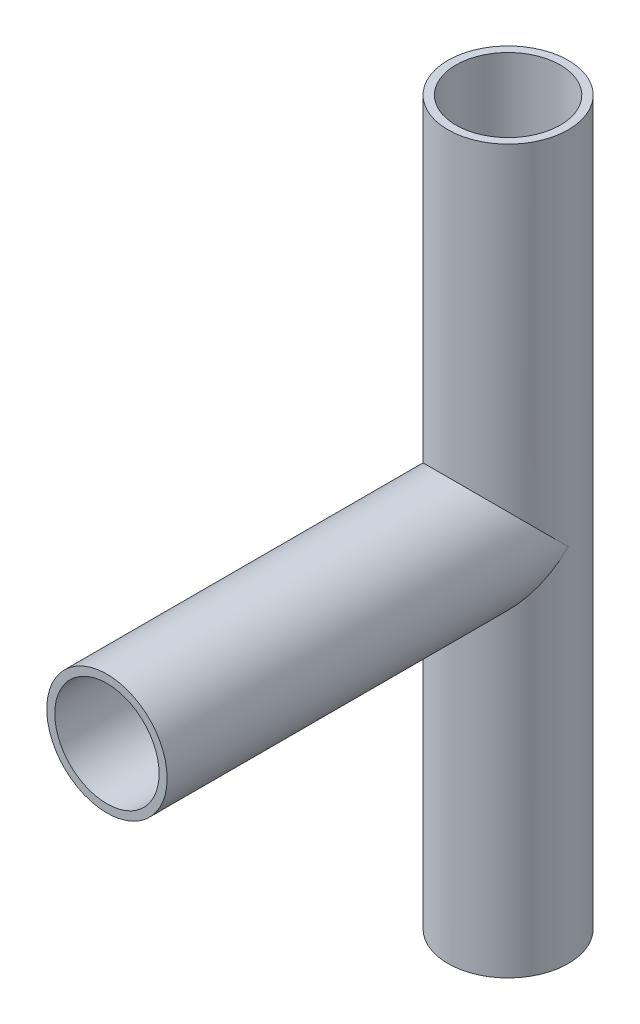
from build123d import *

# Parameters (mm, degrees)
SKETCH1_R               = 15
SKETCH1_R_2             = 13
BOSS_EXTRUDE1_DEPTH     = 100
SKETCH2_R               = 15
CUT_EXTRUDE1_DEPTH      = 100
CUT_EXTRUDE4_DEPTH      = 103.225241628
CUT_EXTRUDE4_DEPTH_BACK = 103.225241628
SKETCH3_R               = 15
SKETCH4_R               = 15
SKETCH4_R_2             = 13
BOSS_EXTRUDE3_DEPTH     = 90
BOSS_EXTRUDE4_START     = 90
SKETCH6_R               = 15
SKETCH6_R_2             = 13
BOSS_EXTRUDE4_DEPTH     = 90


with BuildPart() as part:
    # Sketch1 → Boss-Extrude1 (new body)
    with BuildSketch(Plane.XY):
        Circle(SKETCH1_R)
        Circle(SKETCH1_R_2, mode=Mode.SUBTRACT)
    extrude(amount=BOSS_EXTRUDE1_DEPTH)

    # Sketch2 → Cut-Extrude1 (cut)
    with BuildSketch(Plane(origin=(0, 0, 0), x_dir=(1, 0, 0), z_dir=(0, 1, 0))):
        Circle(SKETCH2_R)
    extrude(amount=-CUT_EXTRUDE1_DEPTH, mode=Mode.SUBTRACT)

    # Sketch3 → Cut-Extrude4 (cut, two sides: drawn at the far end of the back side and taken through both)
    with BuildSketch(Plane(origin=(0, 0, 0), x_dir=(1, 0, 0), z_dir=(0, 1, 0)).offset(-CUT_EXTRUDE4_DEPTH_BACK)):
        Circle(SKETCH3_R)
    extrude(amount=CUT_EXTRUDE4_DEPTH + CUT_EXTRUDE4_DEPTH_BACK, mode=Mode.SUBTRACT)

    # Sketch4 → Boss-Extrude3 (add)
    with BuildSketch(Plane(origin=(0, 0, 0), x_dir=(1, 0, 0), z_dir=(0, 1, 0))):
        with Locations(Location((0, 0, 0), (0, 0, 180))):
            Circle(SKETCH4_R)
        with Locations(Location((0, 0, 0), (0, 0, 90))):
            Circle(SKETCH4_R_2, mode=Mode.SUBTRACT)
    extrude(amount=BOSS_EXTRUDE3_DEPTH)

    # Sketch6 → Boss-Extrude4 (add)
    with BuildSketch(Plane.XZ.offset(BOSS_EXTRUDE4_START)):
        with Locations(Location((0, 0, 0), (0, 0, 270))):
            Circle(SKETCH6_R)
        with Locations(Location((0, 0, 0), (0, 0, 270))):
            Circle(SKETCH6_R_2, mode=Mode.SUBTRACT)
    extrude(amount=-BOSS_EXTRUDE4_DEPTH)


solid = part.part
